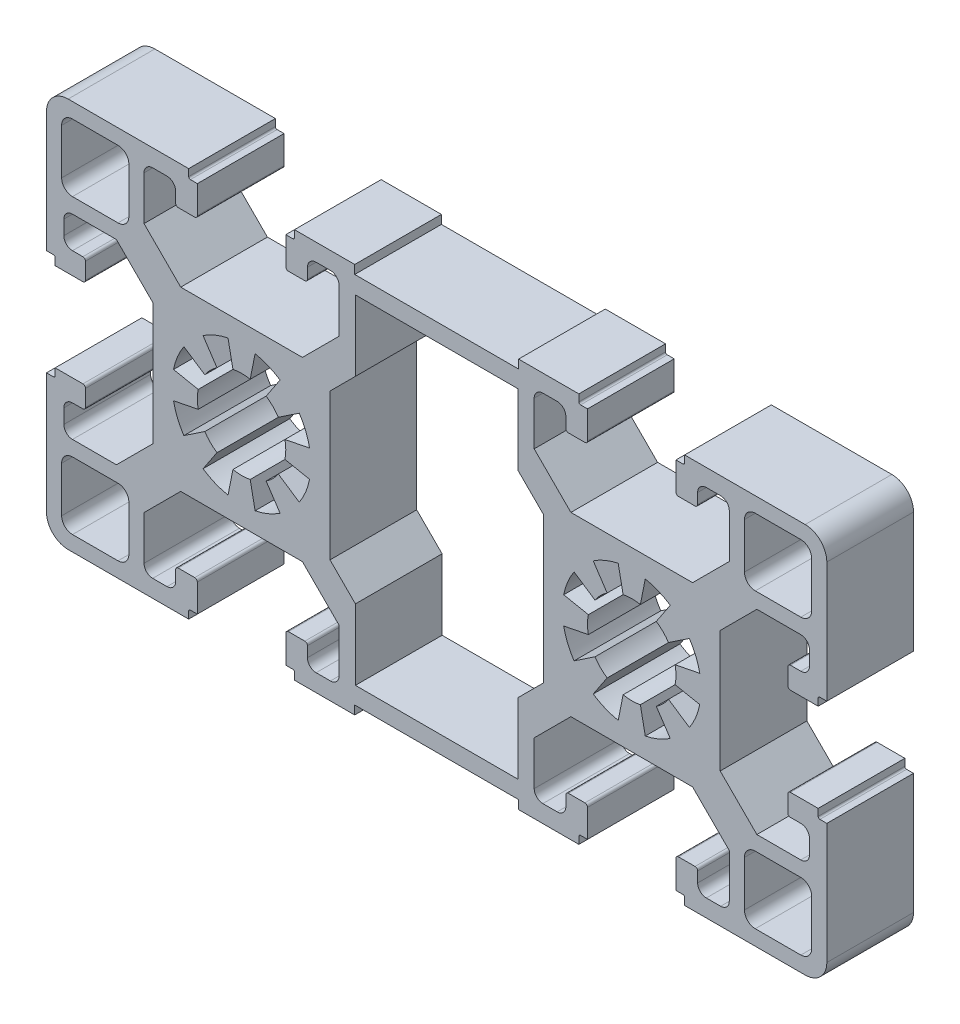
from build123d import *

# Parameters (mm, degrees)
EXTRUDE_1_DEPTH = 10


with BuildPart() as part:
    # 草图1 → 凸台-拉伸1 (new body)
    with BuildSketch(Plane.XY):
        with BuildLine():
            Line((-64.345620469, 3.048211829), (-78.245620469, 3.048211829))
            ThreePointArc((-78.245620469, 3.048211829), (-80.013387422, 2.315978782), (-80.745620469, 0.548211829))
            Line((-80.745620469, 0.548211829), (-80.745620469, -13.351788171))
            Line((-80.745620469, -13.351788171), (-79.945620469, -13.351788171))
            ThreePointArc((-79.945620469, -13.351788171), (-79.804199113, -13.410366814), (-79.745620469, -13.551788171))
            Line((-79.745620469, -13.551788171), (-79.745620469, -14.351788171))
            Line((-79.745620469, -14.351788171), (-76.545620469, -14.351788171))
            ThreePointArc((-76.545620469, -14.351788171), (-76.333488435, -14.263920205), (-76.245620469, -14.051788171))
            Line((-76.245620469, -14.051788171), (-76.245620469, -12.151788171))
            ThreePointArc((-76.245620469, -12.151788171), (-76.333488435, -11.939656136), (-76.545620469, -11.851788171))
            Line((-76.545620469, -11.851788171), (-77.745620469, -11.851788171))
            ThreePointArc((-77.745620469, -11.851788171), (-78.45272725, -11.558894952), (-78.745620469, -10.851788171))
            Line((-78.745620469, -10.851788171), (-78.745620469, -9.201788171))
            ThreePointArc((-78.745620469, -9.201788171), (-78.45272725, -8.494681389), (-77.745620469, -8.201788171))
            Line((-77.745620469, -8.201788171), (-72.677600985, -8.201788171))
            Line((-72.677600985, -8.201788171), (-68.445620469, -12.433768686))
            Line((-68.445620469, -12.433768686), (-68.445620469, -26.469807655))
            Line((-68.445620469, -26.469807655), (-72.677600985, -30.701788171))
            Line((-72.677600985, -30.701788171), (-77.745620469, -30.701788171))
            ThreePointArc((-77.745620469, -30.701788171), (-78.45272725, -30.408894952), (-78.745620469, -29.701788171))
            Line((-78.745620469, -29.701788171), (-78.745620469, -28.051788171))
            ThreePointArc((-78.745620469, -28.051788171), (-78.45272725, -27.344681389), (-77.745620469, -27.051788171))
            Line((-77.745620469, -27.051788171), (-76.545620469, -27.051788171))
            ThreePointArc((-76.545620469, -27.051788171), (-76.333488435, -26.963920205), (-76.245620469, -26.751788171))
            Line((-76.245620469, -26.751788171), (-76.245620469, -24.851788171))
            ThreePointArc((-76.245620469, -24.851788171), (-76.333488435, -24.639656136), (-76.545620469, -24.551788171))
            Line((-76.545620469, -24.551788171), (-79.745620469, -24.551788171))
            Line((-79.745620469, -24.551788171), (-79.745620469, -25.351788171))
            ThreePointArc((-79.745620469, -25.351788171), (-79.804199113, -25.493209527), (-79.945620469, -25.551788171))
            Line((-79.945620469, -25.551788171), (-80.745620469, -25.551788171))
            Line((-80.745620469, -25.551788171), (-80.745620469, -39.451788171))
            ThreePointArc((-80.745620469, -39.451788171), (-80.013387422, -41.219555124), (-78.245620469, -41.951788171))
            Line((-78.245620469, -41.951788171), (-64.345620469, -41.951788171))
            Line((-64.345620469, -41.951788171), (-64.345620469, -41.151788171))
            ThreePointArc((-64.345620469, -41.151788171), (-64.287041825, -41.010366814), (-64.145620469, -40.951788171))
            Line((-64.145620469, -40.951788171), (-63.345620469, -40.951788171))
            Line((-63.345620469, -40.951788171), (-63.345620469, -37.751788171))
            ThreePointArc((-63.345620469, -37.751788171), (-63.433488435, -37.539656136), (-63.645620469, -37.451788171))
            Line((-63.645620469, -37.451788171), (-65.545620469, -37.451788171))
            ThreePointArc((-65.545620469, -37.451788171), (-65.757752504, -37.539656136), (-65.845620469, -37.751788171))
            Line((-65.845620469, -37.751788171), (-65.845620469, -38.951788171))
            ThreePointArc((-65.845620469, -38.951788171), (-66.138513688, -39.658894952), (-66.845620469, -39.951788171))
            Line((-66.845620469, -39.951788171), (-68.495620469, -39.951788171))
            ThreePointArc((-68.495620469, -39.951788171), (-69.20272725, -39.658894952), (-69.495620469, -38.951788171))
            Line((-69.495620469, -38.951788171), (-69.495620469, -33.883768686))
            Line((-69.495620469, -33.883768686), (-65.263639954, -29.651788171))
            Line((-65.263639954, -29.651788171), (-51.227600985, -29.651788171))
            Line((-51.227600985, -29.651788171), (-46.995620469, -33.883768686))
            Line((-46.995620469, -33.883768686), (-46.995620469, -38.951788171))
            ThreePointArc((-46.995620469, -38.951788171), (-47.288513688, -39.658894952), (-47.995620469, -39.951788171))
            Line((-47.995620469, -39.951788171), (-49.645620469, -39.951788171))
            ThreePointArc((-49.645620469, -39.951788171), (-50.35272725, -39.658894952), (-50.645620469, -38.951788171))
            Line((-50.645620469, -38.951788171), (-50.645620469, -37.751788171))
            ThreePointArc((-50.645620469, -37.751788171), (-50.733488435, -37.539656136), (-50.945620469, -37.451788171))
            Line((-50.945620469, -37.451788171), (-52.845620469, -37.451788171))
            ThreePointArc((-52.845620469, -37.451788171), (-53.057752504, -37.539656136), (-53.145620469, -37.751788171))
            Line((-53.145620469, -37.751788171), (-53.145620469, -40.951788171))
            Line((-53.145620469, -40.951788171), (-52.345620469, -40.951788171))
            ThreePointArc((-52.345620469, -40.951788171), (-52.204199113, -41.010366814), (-52.145620469, -41.151788171))
            Line((-52.145620469, -41.151788171), (-52.145620469, -41.951788171))
            Line((-52.145620469, -41.951788171), (-45.195620469, -41.951788171))
            Line((-45.195620469, -41.951788171), (-45.195620469, -40.951788171))
            Line((-45.195620469, -40.951788171), (-26.295620469, -40.951788171))
            Line((-26.295620469, -40.951788171), (-26.295620469, -41.951788171))
            Line((-26.295620469, -41.951788171), (-19.345620469, -41.951788171))
            Line((-19.345620469, -41.951788171), (-19.345620469, -41.151788171))
            ThreePointArc((-19.345620469, -41.151788171), (-19.287041825, -41.010366814), (-19.145620469, -40.951788171))
            Line((-19.145620469, -40.951788171), (-18.345620469, -40.951788171))
            Line((-18.345620469, -40.951788171), (-18.345620469, -37.751788171))
            ThreePointArc((-18.345620469, -37.751788171), (-18.433488435, -37.539656136), (-18.645620469, -37.451788171))
            Line((-18.645620469, -37.451788171), (-20.545620469, -37.451788171))
            ThreePointArc((-20.545620469, -37.451788171), (-20.757752504, -37.539656136), (-20.845620469, -37.751788171))
            Line((-20.845620469, -37.751788171), (-20.845620469, -38.951788171))
            ThreePointArc((-20.845620469, -38.951788171), (-21.138513688, -39.658894952), (-21.845620469, -39.951788171))
            Line((-21.845620469, -39.951788171), (-23.495620469, -39.951788171))
            ThreePointArc((-23.495620469, -39.951788171), (-24.20272725, -39.658894952), (-24.495620469, -38.951788171))
            Line((-24.495620469, -38.951788171), (-24.495620469, -33.883768686))
            Line((-24.495620469, -33.883768686), (-20.263639954, -29.651788171))
            Line((-20.263639954, -29.651788171), (-6.227600985, -29.651788171))
            Line((-6.227600985, -29.651788171), (-1.995620469, -33.883768686))
            Line((-1.995620469, -33.883768686), (-1.995620469, -38.951788171))
            ThreePointArc((-1.995620469, -38.951788171), (-2.288513688, -39.658894952), (-2.995620469, -39.951788171))
            Line((-2.995620469, -39.951788171), (-4.645620469, -39.951788171))
            ThreePointArc((-4.645620469, -39.951788171), (-5.35272725, -39.658894952), (-5.645620469, -38.951788171))
            Line((-5.645620469, -38.951788171), (-5.645620469, -37.751788171))
            ThreePointArc((-5.645620469, -37.751788171), (-5.733488435, -37.539656136), (-5.945620469, -37.451788171))
            Line((-5.945620469, -37.451788171), (-7.845620469, -37.451788171))
            ThreePointArc((-7.845620469, -37.451788171), (-8.057752504, -37.539656136), (-8.145620469, -37.751788171))
            Line((-8.145620469, -37.751788171), (-8.145620469, -40.951788171))
            Line((-8.145620469, -40.951788171), (-7.345620469, -40.951788171))
            ThreePointArc((-7.345620469, -40.951788171), (-7.204199113, -41.010366814), (-7.145620469, -41.151788171))
            Line((-7.145620469, -41.151788171), (-7.145620469, -41.951788171))
            Line((-7.145620469, -41.951788171), (6.754379531, -41.951788171))
            ThreePointArc((6.754379531, -41.951788171), (8.522146484, -41.219555124), (9.254379531, -39.451788171))
            Line((9.254379531, -39.451788171), (9.254379531, -25.551788171))
            Line((9.254379531, -25.551788171), (8.454379531, -25.551788171))
            ThreePointArc((8.454379531, -25.551788171), (8.312958175, -25.493209527), (8.254379531, -25.351788171))
            Line((8.254379531, -25.351788171), (8.254379531, -24.551788171))
            Line((8.254379531, -24.551788171), (5.054379531, -24.551788171))
            ThreePointArc((5.054379531, -24.551788171), (4.842247496, -24.639656136), (4.754379531, -24.851788171))
            Line((4.754379531, -24.851788171), (4.754379531, -26.751788171))
            ThreePointArc((4.754379531, -26.751788171), (4.842247496, -26.963920205), (5.054379531, -27.051788171))
            Line((5.054379531, -27.051788171), (6.254379531, -27.051788171))
            ThreePointArc((6.254379531, -27.051788171), (6.961486312, -27.344681389), (7.254379531, -28.051788171))
            Line((7.254379531, -28.051788171), (7.254379531, -29.701788171))
            ThreePointArc((7.254379531, -29.701788171), (6.961486312, -30.408894952), (6.254379531, -30.701788171))
            Line((6.254379531, -30.701788171), (1.186360046, -30.701788171))
            Line((1.186360046, -30.701788171), (-3.045620469, -26.469807655))
            Line((-3.045620469, -26.469807655), (-3.045620469, -12.433768686))
            Line((-3.045620469, -12.433768686), (1.186360046, -8.201788171))
            Line((1.186360046, -8.201788171), (6.254379531, -8.201788171))
            ThreePointArc((6.254379531, -8.201788171), (6.961486312, -8.494681389), (7.254379531, -9.201788171))
            Line((7.254379531, -9.201788171), (7.254379531, -10.851788171))
            ThreePointArc((7.254379531, -10.851788171), (6.961486312, -11.558894952), (6.254379531, -11.851788171))
            Line((6.254379531, -11.851788171), (5.054379531, -11.851788171))
            ThreePointArc((5.054379531, -11.851788171), (4.842247496, -11.939656136), (4.754379531, -12.151788171))
            Line((4.754379531, -12.151788171), (4.754379531, -14.051788171))
            ThreePointArc((4.754379531, -14.051788171), (4.842247496, -14.263920205), (5.054379531, -14.351788171))
            Line((5.054379531, -14.351788171), (8.254379531, -14.351788171))
            Line((8.254379531, -14.351788171), (8.254379531, -13.551788171))
            ThreePointArc((8.254379531, -13.551788171), (8.312958175, -13.410366814), (8.454379531, -13.351788171))
            Line((8.454379531, -13.351788171), (9.254379531, -13.351788171))
            Line((9.254379531, -13.351788171), (9.254379531, 0.548211829))
            ThreePointArc((9.254379531, 0.548211829), (8.522146484, 2.315978782), (6.754379531, 3.048211829))
            Line((6.754379531, 3.048211829), (-7.145620469, 3.048211829))
            Line((-7.145620469, 3.048211829), (-7.145620469, 2.248211829))
            ThreePointArc((-7.145620469, 2.248211829), (-7.204199113, 2.106790473), (-7.345620469, 2.048211829))
            Line((-7.345620469, 2.048211829), (-8.145620469, 2.048211829))
            Line((-8.145620469, 2.048211829), (-8.145620469, -1.151788171))
            ThreePointArc((-8.145620469, -1.151788171), (-8.057752504, -1.363920205), (-7.845620469, -1.451788171))
            Line((-7.845620469, -1.451788171), (-5.945620469, -1.451788171))
            ThreePointArc((-5.945620469, -1.451788171), (-5.733488435, -1.363920205), (-5.645620469, -1.151788171))
            Line((-5.645620469, -1.151788171), (-5.645620469, 0.048211829))
            ThreePointArc((-5.645620469, 0.048211829), (-5.35272725, 0.755318611), (-4.645620469, 1.048211829))
            Line((-4.645620469, 1.048211829), (-2.995620469, 1.048211829))
            ThreePointArc((-2.995620469, 1.048211829), (-2.288513688, 0.755318611), (-1.995620469, 0.048211829))
            Line((-1.995620469, 0.048211829), (-1.995620469, -5.019807655))
            Line((-1.995620469, -5.019807655), (-6.227600985, -9.251788171))
            Line((-6.227600985, -9.251788171), (-20.263639954, -9.251788171))
            Line((-20.263639954, -9.251788171), (-24.495620469, -5.019807655))
            Line((-24.495620469, -5.019807655), (-24.495620469, 0.048211829))
            ThreePointArc((-24.495620469, 0.048211829), (-24.20272725, 0.755318611), (-23.495620469, 1.048211829))
            Line((-23.495620469, 1.048211829), (-21.845620469, 1.048211829))
            ThreePointArc((-21.845620469, 1.048211829), (-21.138513688, 0.755318611), (-20.845620469, 0.048211829))
            Line((-20.845620469, 0.048211829), (-20.845620469, -1.151788171))
            ThreePointArc((-20.845620469, -1.151788171), (-20.757752504, -1.363920205), (-20.545620469, -1.451788171))
            Line((-20.545620469, -1.451788171), (-18.645620469, -1.451788171))
            ThreePointArc((-18.645620469, -1.451788171), (-18.433488435, -1.363920205), (-18.345620469, -1.151788171))
            Line((-18.345620469, -1.151788171), (-18.345620469, 2.048211829))
            Line((-18.345620469, 2.048211829), (-19.145620469, 2.048211829))
            ThreePointArc((-19.145620469, 2.048211829), (-19.287041825, 2.106790473), (-19.345620469, 2.248211829))
            Line((-19.345620469, 2.248211829), (-19.345620469, 3.048211829))
            Line((-19.345620469, 3.048211829), (-26.295620469, 3.048211829))
            Line((-26.295620469, 3.048211829), (-26.295620469, 2.048211829))
            Line((-26.295620469, 2.048211829), (-45.195620469, 2.048211829))
            Line((-45.195620469, 2.048211829), (-45.195620469, 3.048211829))
            Line((-45.195620469, 3.048211829), (-52.145620469, 3.048211829))
            Line((-52.145620469, 3.048211829), (-52.145620469, 2.248211829))
            ThreePointArc((-52.145620469, 2.248211829), (-52.204199113, 2.106790473), (-52.345620469, 2.048211829))
            Line((-52.345620469, 2.048211829), (-53.145620469, 2.048211829))
            Line((-53.145620469, 2.048211829), (-53.145620469, -1.151788171))
            ThreePointArc((-53.145620469, -1.151788171), (-53.057752504, -1.363920205), (-52.845620469, -1.451788171))
            Line((-52.845620469, -1.451788171), (-50.945620469, -1.451788171))
            ThreePointArc((-50.945620469, -1.451788171), (-50.733488435, -1.363920205), (-50.645620469, -1.151788171))
            Line((-50.645620469, -1.151788171), (-50.645620469, 0.048211829))
            ThreePointArc((-50.645620469, 0.048211829), (-50.35272725, 0.755318611), (-49.645620469, 1.048211829))
            Line((-49.645620469, 1.048211829), (-47.995620469, 1.048211829))
            ThreePointArc((-47.995620469, 1.048211829), (-47.288513688, 0.755318611), (-46.995620469, 0.048211829))
            Line((-46.995620469, 0.048211829), (-46.995620469, -5.019807655))
            Line((-46.995620469, -5.019807655), (-51.227600985, -9.251788171))
            Line((-51.227600985, -9.251788171), (-65.263639954, -9.251788171))
            Line((-65.263639954, -9.251788171), (-69.495620469, -5.019807655))
            Line((-69.495620469, -5.019807655), (-69.495620469, 0.048211829))
            ThreePointArc((-69.495620469, 0.048211829), (-69.20272725, 0.755318611), (-68.495620469, 1.048211829))
            Line((-68.495620469, 1.048211829), (-66.845620469, 1.048211829))
            ThreePointArc((-66.845620469, 1.048211829), (-66.138513688, 0.755318611), (-65.845620469, 0.048211829))
            Line((-65.845620469, 0.048211829), (-65.845620469, -1.151788171))
            ThreePointArc((-65.845620469, -1.151788171), (-65.757752504, -1.363920205), (-65.545620469, -1.451788171))
            Line((-65.545620469, -1.451788171), (-63.645620469, -1.451788171))
            ThreePointArc((-63.645620469, -1.451788171), (-63.433488435, -1.363920205), (-63.345620469, -1.151788171))
            Line((-63.345620469, -1.151788171), (-63.345620469, 2.048211829))
            Line((-63.345620469, 2.048211829), (-64.145620469, 2.048211829))
            ThreePointArc((-64.145620469, 2.048211829), (-64.287041825, 2.106790473), (-64.345620469, 2.248211829))
            Line((-64.345620469, 2.248211829), (-64.345620469, 3.048211829))
        make_face()
        with BuildLine():
            Line((-77.745620469, -6.451788171), (-72.495620469, -6.451788171))
            ThreePointArc((-72.495620469, -6.451788171), (-71.611736993, -6.085671647), (-71.245620469, -5.201788171))
            Line((-71.245620469, -5.201788171), (-71.245620469, 0.048211829))
            ThreePointArc((-71.245620469, 0.048211829), (-71.611736993, 0.932095306), (-72.495620469, 1.298211829))
            Line((-72.495620469, 1.298211829), (-77.745620469, 1.298211829))
            ThreePointArc((-77.745620469, 1.298211829), (-78.629503946, 0.932095306), (-78.995620469, 0.048211829))
            Line((-78.995620469, 0.048211829), (-78.995620469, -5.201788171))
            ThreePointArc((-78.995620469, -5.201788171), (-78.629503946, -6.085671647), (-77.745620469, -6.451788171))
        make_face(mode=Mode.SUBTRACT)
        with BuildLine():
            Line((-77.745620469, -32.451788171), (-72.495620469, -32.451788171))
            ThreePointArc((-72.495620469, -32.451788171), (-71.611736993, -32.817904694), (-71.245620469, -33.701788171))
            Line((-71.245620469, -33.701788171), (-71.245620469, -38.951788171))
            ThreePointArc((-71.245620469, -38.951788171), (-71.611736993, -39.835671647), (-72.495620469, -40.201788171))
            Line((-72.495620469, -40.201788171), (-77.745620469, -40.201788171))
            ThreePointArc((-77.745620469, -40.201788171), (-78.629503946, -39.835671647), (-78.995620469, -38.951788171))
            Line((-78.995620469, -38.951788171), (-78.995620469, -33.701788171))
            ThreePointArc((-78.995620469, -33.701788171), (-78.629503946, -32.817904694), (-77.745620469, -32.451788171))
        make_face(mode=Mode.SUBTRACT)
        with BuildLine():
            Line((-62.690182333, -26.103545069), (-61.079028658, -23.692283193))
            ThreePointArc((-61.079028658, -23.692283193), (-61.851865053, -23.058032755), (-62.486115492, -22.285196359))
            Line((-62.486115492, -22.285196359), (-64.897377368, -23.896350035))
            ThreePointArc((-64.897377368, -23.896350035), (-65.636656729, -22.513255629), (-66.091902712, -21.012510747))
            Line((-66.091902712, -21.012510747), (-63.247625399, -20.446748813))
            ThreePointArc((-63.247625399, -20.446748813), (-63.345620469, -19.451788171), (-63.247625399, -18.456827528))
            Line((-63.247625399, -18.456827528), (-66.091902712, -17.891065594))
            ThreePointArc((-66.091902712, -17.891065594), (-65.636656729, -16.390320712), (-64.897377368, -15.007226306))
            Line((-64.897377368, -15.007226306), (-62.486115492, -16.618379982))
            ThreePointArc((-62.486115492, -16.618379982), (-61.851865053, -15.845543587), (-61.079028658, -15.211293148))
            Line((-61.079028658, -15.211293148), (-62.690182333, -12.800031272))
            ThreePointArc((-62.690182333, -12.800031272), (-61.307087928, -12.06075191), (-59.806343045, -11.605505927))
            Line((-59.806343045, -11.605505927), (-59.240581111, -14.449783241))
            ThreePointArc((-59.240581111, -14.449783241), (-58.245620469, -14.351788171), (-57.250659827, -14.449783241))
            Line((-57.250659827, -14.449783241), (-56.684897893, -11.605505927))
            ThreePointArc((-56.684897893, -11.605505927), (-55.18415301, -12.06075191), (-53.801058605, -12.800031272))
            Line((-53.801058605, -12.800031272), (-55.412212281, -15.211293148))
            ThreePointArc((-55.412212281, -15.211293148), (-54.639375885, -15.845543587), (-54.005125446, -16.618379982))
            Line((-54.005125446, -16.618379982), (-51.593863571, -15.007226306))
            ThreePointArc((-51.593863571, -15.007226306), (-50.854584209, -16.390320712), (-50.399338226, -17.891065594))
            Line((-50.399338226, -17.891065594), (-53.243615539, -18.456827528))
            ThreePointArc((-53.243615539, -18.456827528), (-53.145620469, -19.451788171), (-53.243615539, -20.446748813))
            Line((-53.243615539, -20.446748813), (-50.399338226, -21.012510747))
            ThreePointArc((-50.399338226, -21.012510747), (-50.854584209, -22.513255629), (-51.593863571, -23.896350035))
            Line((-51.593863571, -23.896350035), (-54.005125446, -22.285196359))
            ThreePointArc((-54.005125446, -22.285196359), (-54.639375885, -23.058032755), (-55.412212281, -23.692283193))
            Line((-55.412212281, -23.692283193), (-53.801058605, -26.103545069))
            ThreePointArc((-53.801058605, -26.103545069), (-55.18415301, -26.842824431), (-56.684897893, -27.298070414))
            Line((-56.684897893, -27.298070414), (-57.250659827, -24.453793101))
            ThreePointArc((-57.250659827, -24.453793101), (-58.245620469, -24.551788171), (-59.240581111, -24.453793101))
            Line((-59.240581111, -24.453793101), (-59.806343045, -27.298070414))
            ThreePointArc((-59.806343045, -27.298070414), (-61.307087928, -26.842824431), (-62.690182333, -26.103545069))
        make_face(mode=Mode.SUBTRACT)
        with BuildLine():
            Line((6.254379531, -6.451788171), (1.004379531, -6.451788171))
            ThreePointArc((1.004379531, -6.451788171), (0.120496054, -6.085671647), (-0.245620469, -5.201788171))
            Line((-0.245620469, -5.201788171), (-0.245620469, 0.048211829))
            ThreePointArc((-0.245620469, 0.048211829), (0.120496054, 0.932095306), (1.004379531, 1.298211829))
            Line((1.004379531, 1.298211829), (6.254379531, 1.298211829))
            ThreePointArc((6.254379531, 1.298211829), (7.138263007, 0.932095306), (7.504379531, 0.048211829))
            Line((7.504379531, 0.048211829), (7.504379531, -5.201788171))
            ThreePointArc((7.504379531, -5.201788171), (7.138263007, -6.085671647), (6.254379531, -6.451788171))
        make_face(mode=Mode.SUBTRACT)
        with BuildLine():
            Line((6.254379531, -32.451788171), (1.004379531, -32.451788171))
            ThreePointArc((1.004379531, -32.451788171), (0.120496054, -32.817904694), (-0.245620469, -33.701788171))
            Line((-0.245620469, -33.701788171), (-0.245620469, -38.951788171))
            ThreePointArc((-0.245620469, -38.951788171), (0.120496054, -39.835671647), (1.004379531, -40.201788171))
            Line((1.004379531, -40.201788171), (6.254379531, -40.201788171))
            ThreePointArc((6.254379531, -40.201788171), (7.138263007, -39.835671647), (7.504379531, -38.951788171))
            Line((7.504379531, -38.951788171), (7.504379531, -33.701788171))
            ThreePointArc((7.504379531, -33.701788171), (7.138263007, -32.817904694), (6.254379531, -32.451788171))
        make_face(mode=Mode.SUBTRACT)
        with BuildLine():
            Line((-17.690182333, -26.103545069), (-16.079028658, -23.692283193))
            ThreePointArc((-16.079028658, -23.692283193), (-16.851865053, -23.058032755), (-17.486115492, -22.285196359))
            Line((-17.486115492, -22.285196359), (-19.897377368, -23.896350035))
            ThreePointArc((-19.897377368, -23.896350035), (-20.636656729, -22.513255629), (-21.091902712, -21.012510747))
            Line((-21.091902712, -21.012510747), (-18.247625399, -20.446748813))
            ThreePointArc((-18.247625399, -20.446748813), (-18.345620469, -19.451788171), (-18.247625399, -18.456827528))
            Line((-18.247625399, -18.456827528), (-21.091902712, -17.891065594))
            ThreePointArc((-21.091902712, -17.891065594), (-20.636656729, -16.390320712), (-19.897377368, -15.007226306))
            Line((-19.897377368, -15.007226306), (-17.486115492, -16.618379982))
            ThreePointArc((-17.486115492, -16.618379982), (-16.851865053, -15.845543587), (-16.079028658, -15.211293148))
            Line((-16.079028658, -15.211293148), (-17.690182333, -12.800031272))
            ThreePointArc((-17.690182333, -12.800031272), (-16.307087928, -12.06075191), (-14.806343045, -11.605505927))
            Line((-14.806343045, -11.605505927), (-14.240581111, -14.449783241))
            ThreePointArc((-14.240581111, -14.449783241), (-13.245620469, -14.351788171), (-12.250659827, -14.449783241))
            Line((-12.250659827, -14.449783241), (-11.684897893, -11.605505927))
            ThreePointArc((-11.684897893, -11.605505927), (-10.18415301, -12.06075191), (-8.801058605, -12.800031272))
            Line((-8.801058605, -12.800031272), (-10.412212281, -15.211293148))
            ThreePointArc((-10.412212281, -15.211293148), (-9.639375885, -15.845543587), (-9.005125446, -16.618379982))
            Line((-9.005125446, -16.618379982), (-6.593863571, -15.007226306))
            ThreePointArc((-6.593863571, -15.007226306), (-5.854584209, -16.390320712), (-5.399338226, -17.891065594))
            Line((-5.399338226, -17.891065594), (-8.243615539, -18.456827528))
            ThreePointArc((-8.243615539, -18.456827528), (-8.145620469, -19.451788171), (-8.243615539, -20.446748813))
            Line((-8.243615539, -20.446748813), (-5.399338226, -21.012510747))
            ThreePointArc((-5.399338226, -21.012510747), (-5.854584209, -22.513255629), (-6.593863571, -23.896350035))
            Line((-6.593863571, -23.896350035), (-9.005125446, -22.285196359))
            ThreePointArc((-9.005125446, -22.285196359), (-9.639375885, -23.058032755), (-10.412212281, -23.692283193))
            Line((-10.412212281, -23.692283193), (-8.801058605, -26.103545069))
            ThreePointArc((-8.801058605, -26.103545069), (-10.18415301, -26.842824431), (-11.684897893, -27.298070414))
            Line((-11.684897893, -27.298070414), (-12.250659827, -24.453793101))
            ThreePointArc((-12.250659827, -24.453793101), (-13.245620469, -24.551788171), (-14.240581111, -24.453793101))
            Line((-14.240581111, -24.453793101), (-14.806343045, -27.298070414))
            ThreePointArc((-14.806343045, -27.298070414), (-16.307087928, -26.842824431), (-17.690182333, -26.103545069))
        make_face(mode=Mode.SUBTRACT)
        Polygon((-45.116255265, 0.048211829), (-26.374985673, 0.048211829), (-26.374985673, -8.09018992), (-23.445620469, -11.019555124), (-23.445620469, -27.884021218), (-26.374985673, -30.813386422), (-26.374985673, -38.951788171), (-45.116255265, -38.951788171), (-45.116255265, -30.813386422), (-48.045620469, -27.884021218), (-48.045620469, -11.019555124), (-45.116255265, -8.09018992), align=None, mode=Mode.SUBTRACT)
    extrude(amount=EXTRUDE_1_DEPTH)


solid = part.part
